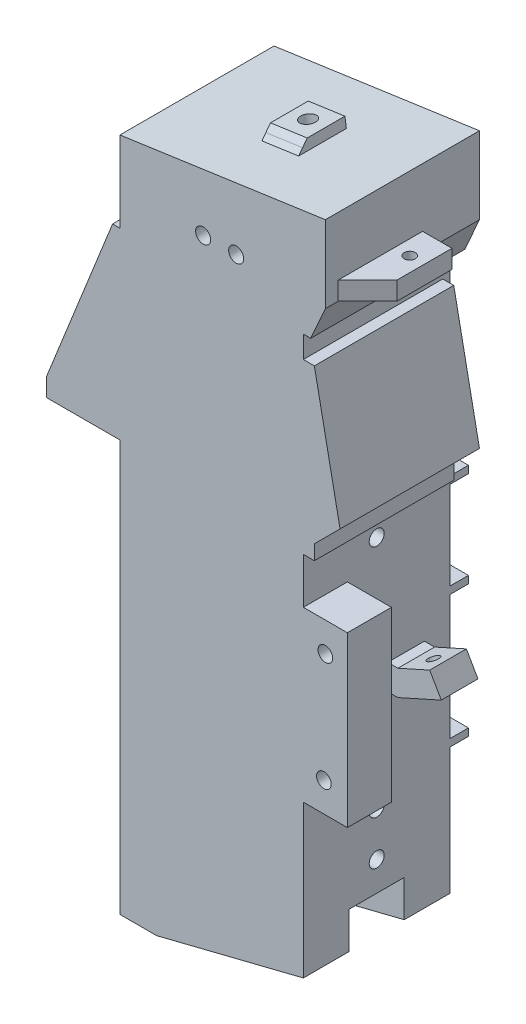
from build123d import *

# Parameters (mm, degrees)
CROQUIS1_W                  = 50
CROQUIS1_H                  = 184
SALIENTE_EXTRUIR1_DEPTH     = 40
CORTAR_EXTRUIR1_DEPTH       = 40
CROQUIS3_R                  = 2
SALIENTE_EXTRUIR2_DEPTH     = 40
SALIENTE_EXTRUIR3_DEPTH     = 38
SALIENTE_EXTRUIR4_DEPTH     = 40
CROQUIS9_W                  = 28
CROQUIS9_H                  = 46
CORTAR_EXTRUIR6_DEPTH       = 12
CORTAR_EXTRUIR8_DEPTH       = 12
CROQUIS13_W                 = 3.499793878
CROQUIS13_H                 = 12
SALIENTE_EXTRUIR5_DEPTH     = 12
CROQUIS14_R                 = 1.5
CORTAR_EXTRUIR9_DEPTH       = 12
CROQUIS16_W                 = 10
CROQUIS16_H                 = 6.928
SALIENTE_EXTRUIR6_DEPTH     = 2.773
SALIENTE_EXTRUIR7_DEPTH     = 5
CROQUIS19_R                 = 1.5
CORTAR_EXTRUIR10_DEPTH      = 10
CROQUIS20_W                 = 40
CROQUIS20_H                 = 15
CORTAR_EXTRUIR11_DEPTH      = 20
SALIENTE_EXTRUIR8_DEPTH     = 40
SALIENTE_EXTRUIR9_DEPTH     = 40
SALIENTE_EXTRUIR10_DEPTH    = 2
CROQUIS25_W                 = 18
CROQUIS25_H                 = 15
CORTAR_EXTRUIR12_DEPTH      = 45
CROQUIS26_R                 = 1.6
CORTAR_EXTRUIR13_DEPTH      = 45
SALIENTE_EXTRUIR11_DEPTH    = 1
CROQUIS29_W                 = 48.431
CROQUIS29_H                 = 1.5
CROQUIS29_W_2               = 1.5
CROQUIS29_H_2               = 41.5
SALIENTE_EXTRUIR12_DEPTH    = 1
CROQUIS30_W                 = 50
CROQUIS30_H                 = 2
SALIENTE_EXTRUIR13_DEPTH    = 5
SALIENTE_EXTRUIR14_DEPTH    = 24
CORTAR_EXTRUIR14_DEPTH      = 5
CROQUIS33_W                 = 50
CROQUIS33_H                 = 5
SALIENTE_EXTRUIR15_DEPTH    = 2
SALIENTE_EXTRUIR16_DEPTH    = 34
CROQUIS35_W                 = 50
CROQUIS35_H                 = 5
SALIENTE_EXTRUIR17_DEPTH    = 2
CROQUIS36_R                 = 1.6
CORTAR_EXTRUIR15_DEPTH      = 123.497795141
CROQUIS37_R                 = 2.05
CORTAR_EXTRUIR16_DEPTH      = 6
CROQUIS38_R                 = 2.05
CORTAR_EXTRUIR17_DEPTH      = 6
CROQUIS39_W                 = 10.109
CROQUIS39_H                 = 13
SALIENTE_EXTRUIR18_DEPTH    = 2.741
CORTAR_EXTRUIR18_DEPTH      = 123.414338069
CROQUIS42_R                 = 2.05
CORTAR_EXTRUIR19_DEPTH      = 6
CORTAR_EXTRUIR20_DEPTH      = 134.419994789
CORTAR_EXTRUIR20_DEPTH_BACK = 134.419994789
CROQUIS44_W                 = 64.640952058
CROQUIS44_H                 = 86.005379165
CORTAR_EXTRUIR21_DEPTH      = 134.419994789


with BuildPart() as part:
    # Croquis1 → Saliente-Extruir1 (new body)
    with BuildSketch(Plane.XY):
        Rectangle(CROQUIS1_W, CROQUIS1_H)
    saliente_extruir1 = extrude(amount=SALIENTE_EXTRUIR1_DEPTH)

    # Croquis2 → Cortar-Extruir1 (cut)
    with BuildSketch(Plane.XY.offset(40)):
        Polygon((-15, -92), (25, -82.000231953), (25, -92), align=None)
    cortar_extruir1 = extrude(amount=-CORTAR_EXTRUIR1_DEPTH, mode=Mode.SUBTRACT)

    # Croquis3 → Saliente-Extruir2 (add, through all)
    with BuildSketch(Plane.XY.offset(40)):
        Polygon((25, -40.500231953), (17.257871302, -40.500231953), (17.257871302, 5.499768047), (23, 5.499768047), (37, 5.499768047), (37, -40.500231953), align=None)
        with Locations((30.600037882, -32.500231953)):
            Circle(CROQUIS3_R, mode=Mode.SUBTRACT)
        with Locations((31, -2.500231953)):
            Circle(CROQUIS3_R, mode=Mode.SUBTRACT)
    saliente_extruir2 = extrude(amount=-SALIENTE_EXTRUIR2_DEPTH)

    # Croquis7 → Saliente-Extruir3 (add)
    with BuildSketch(Plane(origin=(0, 0, 0), x_dir=(-1, 0, 0), z_dir=(0, 0, -1))):
        Polygon((-25, 17.999768047), (-28, 17.999768047), (-28, 21.999768047), (-34.999650027, 28.999418074), (-27.999635566, 63.999275882), (-25, 63.999275882), align=None)
    saliente_extruir3 = extrude(amount=-SALIENTE_EXTRUIR3_DEPTH)

    # Croquis8 → Saliente-Extruir4 (add, through all)
    with BuildSketch(Plane(origin=(0, 0, 0), x_dir=(-1, 0, 0), z_dir=(0, 0, -1))):
        Polygon((-25, 69.999275882), (-27, 69.999275882), (-31.000138025, 78.999370147), (-42.314138025, 78.999370147), (-42.314138025, 83.999370147), (-31.000138025, 83.999370147), (-31.000138025, 92), (-25, 92), align=None)
    saliente_extruir4 = extrude(amount=-SALIENTE_EXTRUIR4_DEPTH)

    # Croquis9 → Cortar-Extruir6 (cut)
    with BuildSketch(Plane(origin=(37, 0, 0), x_dir=(0, 0, -1), z_dir=(1, 0, 0))):
        with Locations((-26, -17.500231953)):
            Rectangle(CROQUIS9_W, CROQUIS9_H)
    cortar_extruir6 = extrude(amount=-CORTAR_EXTRUIR6_DEPTH, mode=Mode.SUBTRACT)

    # Croquis10 → Cortar-Extruir8 (cut)
    with BuildSketch(Plane.XZ.offset(-78.999370147)):
        Polygon((31.000138025, 40), (31.000138025, 26.5), (39.000138025, 26.5), (39.000138025, 11.5), (30.999931903, 3.499793878), (31.000138025, 0), (42.314138025, 0), (42.314138025, 40), align=None)
    cortar_extruir8 = extrude(amount=-CORTAR_EXTRUIR8_DEPTH, mode=Mode.SUBTRACT)

    # Croquis13 → Saliente-Extruir5 (add)
    with BuildSketch(Plane(origin=(31.000138025, 0, 0), x_dir=(0, 0, -1), z_dir=(1, 0, 0))):
        with Locations((-1.749896939, 84.999370147)):
            Rectangle(CROQUIS13_W, CROQUIS13_H)
    saliente_extruir5 = extrude(amount=-SALIENTE_EXTRUIR5_DEPTH)

    # Croquis14 → Cortar-Extruir9 (cut)
    with BuildSketch(Plane.XZ.offset(-78.999370147)):
        with Locations(Location((35.000138025, 19, 0), (0, 0, 270))):
            Circle(CROQUIS14_R)
    cortar_extruir9 = extrude(amount=-CORTAR_EXTRUIR9_DEPTH, mode=Mode.SUBTRACT)

    # Croquis16 → Saliente-Extruir6 (add)
    with BuildSketch(Plane(origin=(25, 0, 0), x_dir=(0, 0, -1), z_dir=(1, 0, 0))):
        with Locations((-28, -22.455231953)):
            Rectangle(CROQUIS16_W, CROQUIS16_H)
    saliente_extruir6 = extrude(amount=SALIENTE_EXTRUIR6_DEPTH)

    # Croquis3D1 → Saliente-Extruir7 (add, symmetric)
    with BuildSketch(Plane(origin=(27.773, -25.919231953, 28), x_dir=(0.6249550138681161, 0.7806607654039639, 0), z_dir=(0, 0, -1))):
        Polygon((0, 0), (11.53931357, 5.90842943), (13.864409677, 0), (5.408417783, -4.329688336), align=None)
    saliente_extruir7 = extrude(amount=SALIENTE_EXTRUIR7_DEPTH, both=True)

    # Croquis19 → Cortar-Extruir10 (cut)
    with BuildSketch(Plane(origin=(14.363025456, -31.948019069, 0), x_dir=(0.9120665622973847, 0.41004217580516156, 0), z_dir=(0.4100421758051615, -0.9120665622973846, 0))):
        with Locations((22.66684637, 28)):
            Circle(CROQUIS19_R)
    cortar_extruir10 = extrude(amount=-CORTAR_EXTRUIR10_DEPTH, mode=Mode.SUBTRACT)

    # Croquis20 → Cortar-Extruir11 (cut)
    with BuildSketch(Plane.XZ.offset(92)):
        with Locations((5, 20)):
            Rectangle(CROQUIS20_W, CROQUIS20_H)
    cortar_extruir11 = extrude(amount=-CORTAR_EXTRUIR11_DEPTH, mode=Mode.SUBTRACT)

    # Croquis21 → Saliente-Extruir8 (add)
    with BuildSketch(Plane(origin=(0, 0, 0), x_dir=(-1, 0, 0), z_dir=(0, 0, -1))):
        Polygon((25, 70), (27, 70), (45, 25), (45, 20), (25, 20), align=None)
    saliente_extruir8 = extrude(amount=-SALIENTE_EXTRUIR8_DEPTH)

    # Croquis22 → Saliente-Extruir9 (add)
    with BuildSketch(Plane.XY.offset(40)):
        Polygon((-25, 92), (31.000138025, 99.999370147), (31.000138025, 92), align=None)
    saliente_extruir9 = extrude(amount=-SALIENTE_EXTRUIR9_DEPTH)

    # Croquis23 → Saliente-Extruir10 (add)
    with BuildSketch(Plane.XY.offset(40)):
        Polygon((-25, 70), (25, 69.999275882), (27, 69.999275882), (31.000138025, 78.999370147), (31.000138025, 99.999370147), (-25, 92), align=None)
    saliente_extruir10 = extrude(amount=SALIENTE_EXTRUIR10_DEPTH)

    # Croquis25 → Cortar-Extruir12 (cut)
    with BuildSketch(Plane(origin=(0, 70, 0), x_dir=(1, 0, 0), z_dir=(0, 1, 0))):
        with Locations((-36, -20)):
            Rectangle(CROQUIS25_W, CROQUIS25_H)
    cortar_extruir12 = extrude(amount=-CORTAR_EXTRUIR12_DEPTH, mode=Mode.SUBTRACT)

    # Croquis26 → Cortar-Extruir13 (cut)
    with BuildSketch(Plane(origin=(0, 25, 0), x_dir=(1, 0, 0), z_dir=(0, 1, 0))):
        with Locations(Location((-36, -20, 0), (0, 0, 270))):
            Circle(CROQUIS26_R)
    cortar_extruir13 = extrude(amount=-CORTAR_EXTRUIR13_DEPTH, mode=Mode.SUBTRACT)

    # Croquis28 → Saliente-Extruir11 (add)
    with BuildSketch(Plane.XY.offset(40)):
        Polygon((-30.431, 20), (18, 20), (18, 63), (-18.529, 63), (-30.431, 43.969), align=None)
    saliente_extruir11 = extrude(amount=SALIENTE_EXTRUIR11_DEPTH)

    # Croquis29 → Saliente-Extruir12 (add)
    with BuildSketch(Plane.XY.offset(41)):
        with Locations((-6.2155, 20.75)):
            Rectangle(CROQUIS29_W, CROQUIS29_H)
        with Locations((-15.169, 42.25)):
            Rectangle(CROQUIS29_W_2, CROQUIS29_H_2)
        Polygon((-15.919, 47.99), (18, 47.99), (18, 46.49), (-28.854364931, 46.49), (-27.916263938, 47.99), align=None)
    saliente_extruir12 = extrude(amount=SALIENTE_EXTRUIR12_DEPTH)

    # Croquis30 → Saliente-Extruir13 (add)
    with BuildSketch(Plane.XY.offset(40)):
        with Locations((0, 15.538)):
            Rectangle(CROQUIS30_W, CROQUIS30_H)
    saliente_extruir13 = extrude(amount=SALIENTE_EXTRUIR13_DEPTH)

    # Croquis31 → Saliente-Extruir14 (add)
    with BuildSketch(Plane.XZ.offset(-14.538)):
        Polygon((-25, 40), (-20.000095901, 45), (8.461904099, 45), (25, 40), align=None)
    saliente_extruir14 = extrude(amount=SALIENTE_EXTRUIR14_DEPTH)

    # Croquis32 → Cortar-Extruir14 (cut)
    with BuildSketch(Plane.XY.offset(45)):
        Polygon((-20.000095901, 14.538), (-25, 7.467175508), (-25, 14.538), align=None)
    cortar_extruir14 = extrude(amount=-CORTAR_EXTRUIR14_DEPTH, mode=Mode.SUBTRACT)

    # Croquis33 → Saliente-Extruir15 (add)
    with BuildSketch(Plane.XZ.offset(9.462)):
        with Locations((0, 42.5)):
            Rectangle(CROQUIS33_W, CROQUIS33_H)
    saliente_extruir15 = extrude(amount=SALIENTE_EXTRUIR15_DEPTH)

    # Croquis34 → Saliente-Extruir16 (add)
    with BuildSketch(Plane.XZ.offset(11.462)):
        Polygon((-25, 40), (-9.51943722, 45), (19.99956278, 45), (25, 40), align=None)
    saliente_extruir16 = extrude(amount=SALIENTE_EXTRUIR16_DEPTH)

    # Croquis35 → Saliente-Extruir17 (add)
    with BuildSketch(Plane.XZ.offset(45.462)):
        with Locations((0, 42.5)):
            Rectangle(CROQUIS35_W, CROQUIS35_H)
    saliente_extruir17 = extrude(amount=SALIENTE_EXTRUIR17_DEPTH)

    # Croquis36 → Cortar-Extruir15 (cut, through all)
    with BuildSketch(Plane(origin=(-15, 0, 0), x_dir=(0, 0, -1), z_dir=(1, 0, 0))):
        with Locations((-20, -82)):
            Circle(CROQUIS36_R)
    cortar_extruir15 = extrude(amount=-CORTAR_EXTRUIR15_DEPTH, mode=Mode.SUBTRACT)

    # Croquis37 → Cortar-Extruir16 (cut)
    with BuildSketch(Plane(origin=(25, 0, 0), x_dir=(0, 0, -1), z_dir=(1, 0, 0))):
        with Locations((-20, -64)):
            Circle(CROQUIS37_R)
        with Locations((-20, -52)):
            Circle(CROQUIS37_R)
        with Locations((-20, 12)):
            Circle(CROQUIS37_R)
    cortar_extruir16 = extrude(amount=-CORTAR_EXTRUIR16_DEPTH, mode=Mode.SUBTRACT)

    # Croquis38 → Cortar-Extruir17 (cut)
    with BuildSketch(Plane(origin=(0, 0, 0), x_dir=(-1, 0, 0), z_dir=(0, 0, -1))):
        with Locations((-6.684, 79.619334724)):
            Circle(CROQUIS38_R)
        with Locations((2.316, 79.619334724)):
            Circle(CROQUIS38_R)
    cortar_extruir17 = extrude(amount=-CORTAR_EXTRUIR17_DEPTH, mode=Mode.SUBTRACT)

    # Croquis39 → Saliente-Extruir18 (add)
    with BuildSketch(Plane(origin=(-13.378916452, 93.660019994, 0), x_dir=(0.9899511012015357, 0.14141010299786488, 0), z_dir=(-0.14141010299786488, 0.9899511012015357, 0))):
        with Locations((17.775042007, -21)):
            Rectangle(CROQUIS39_W, CROQUIS39_H)
    saliente_extruir18 = extrude(amount=SALIENTE_EXTRUIR18_DEPTH)

    # Croquis40 → Cortar-Extruir18 (cut, through all)
    with BuildSketch(Plane(origin=(12.592714568, 1.798813155, 0), x_dir=(0, 0, 1), z_dir=(-0.9899511012015357, -0.14141010299786488, 0))):
        Polygon((14.5, 94.610753885), (15.746, 95.869753885), (17.211, 97.351753885), (14.5, 97.351753885), align=None)
    cortar_extruir18 = extrude(amount=-CORTAR_EXTRUIR18_DEPTH, mode=Mode.SUBTRACT)

    # Croquis42 → Cortar-Extruir19 (cut)
    with BuildSketch(Plane(origin=(-13.766521544, 96.373475963, 0), x_dir=(0.9899511012015357, 0.14141010299786486, 0), z_dir=(-0.14141010299786486, 0.9899511012015357, 0))):
        with Locations(Location((17.720542007, -22.5, 0), (0, 0, 180))):
            Circle(CROQUIS42_R)
    cortar_extruir19 = extrude(amount=-CORTAR_EXTRUIR19_DEPTH, mode=Mode.SUBTRACT)

    # Simetría1: Saliente-Extruir1, Cortar-Extruir1, Saliente-Extruir2, Saliente-Extruir3, Saliente-Extruir4, Cortar-Extruir6, Cortar-Extruir8, Saliente-Extruir5, Cortar-Extruir9, Saliente-Extruir6, Saliente-Extruir7, Cortar-Extruir10, Cortar-Extruir11, Saliente-Extruir8, Saliente-Extruir9, Saliente-Extruir10, Cortar-Extruir12, Cortar-Extruir13, Saliente-Extruir11, Saliente-Extruir12, Saliente-Extruir13, Saliente-Extruir14, Cortar-Extruir14, Saliente-Extruir15, Saliente-Extruir16, Saliente-Extruir17, Cortar-Extruir15, Cortar-Extruir16, Cortar-Extruir17, Saliente-Extruir18, Cortar-Extruir18, Cortar-Extruir19 across plane
    add(saliente_extruir1.mirror(Plane(origin=(0, 0, 0), x_dir=(1, 0, 0), z_dir=(0, 0, -1))))
    add(cortar_extruir1.mirror(Plane(origin=(0, 0, 0), x_dir=(1, 0, 0), z_dir=(0, 0, -1))), mode=Mode.SUBTRACT)
    add(saliente_extruir2.mirror(Plane(origin=(0, 0, 0), x_dir=(1, 0, 0), z_dir=(0, 0, -1))))
    add(saliente_extruir3.mirror(Plane(origin=(0, 0, 0), x_dir=(1, 0, 0), z_dir=(0, 0, -1))))
    add(saliente_extruir4.mirror(Plane(origin=(0, 0, 0), x_dir=(1, 0, 0), z_dir=(0, 0, -1))))
    add(cortar_extruir6.mirror(Plane(origin=(0, 0, 0), x_dir=(1, 0, 0), z_dir=(0, 0, -1))), mode=Mode.SUBTRACT)
    add(cortar_extruir8.mirror(Plane(origin=(0, 0, 0), x_dir=(1, 0, 0), z_dir=(0, 0, -1))), mode=Mode.SUBTRACT)
    add(saliente_extruir5.mirror(Plane(origin=(0, 0, 0), x_dir=(1, 0, 0), z_dir=(0, 0, -1))))
    add(cortar_extruir9.mirror(Plane(origin=(0, 0, 0), x_dir=(1, 0, 0), z_dir=(0, 0, -1))), mode=Mode.SUBTRACT)
    add(saliente_extruir6.mirror(Plane(origin=(0, 0, 0), x_dir=(1, 0, 0), z_dir=(0, 0, -1))))
    add(saliente_extruir7.mirror(Plane(origin=(0, 0, 0), x_dir=(1, 0, 0), z_dir=(0, 0, -1))))
    add(cortar_extruir10.mirror(Plane(origin=(0, 0, 0), x_dir=(1, 0, 0), z_dir=(0, 0, -1))), mode=Mode.SUBTRACT)
    add(cortar_extruir11.mirror(Plane(origin=(0, 0, 0), x_dir=(1, 0, 0), z_dir=(0, 0, -1))), mode=Mode.SUBTRACT)
    add(saliente_extruir8.mirror(Plane(origin=(0, 0, 0), x_dir=(1, 0, 0), z_dir=(0, 0, -1))))
    add(saliente_extruir9.mirror(Plane(origin=(0, 0, 0), x_dir=(1, 0, 0), z_dir=(0, 0, -1))))
    add(saliente_extruir10.mirror(Plane(origin=(0, 0, 0), x_dir=(1, 0, 0), z_dir=(0, 0, -1))))
    add(cortar_extruir12.mirror(Plane(origin=(0, 0, 0), x_dir=(1, 0, 0), z_dir=(0, 0, -1))), mode=Mode.SUBTRACT)
    add(cortar_extruir13.mirror(Plane(origin=(0, 0, 0), x_dir=(1, 0, 0), z_dir=(0, 0, -1))), mode=Mode.SUBTRACT)
    add(saliente_extruir11.mirror(Plane(origin=(0, 0, 0), x_dir=(1, 0, 0), z_dir=(0, 0, -1))))
    add(saliente_extruir12.mirror(Plane(origin=(0, 0, 0), x_dir=(1, 0, 0), z_dir=(0, 0, -1))))
    add(saliente_extruir13.mirror(Plane(origin=(0, 0, 0), x_dir=(1, 0, 0), z_dir=(0, 0, -1))))
    add(saliente_extruir14.mirror(Plane(origin=(0, 0, 0), x_dir=(1, 0, 0), z_dir=(0, 0, -1))))
    add(cortar_extruir14.mirror(Plane(origin=(0, 0, 0), x_dir=(1, 0, 0), z_dir=(0, 0, -1))), mode=Mode.SUBTRACT)
    add(saliente_extruir15.mirror(Plane(origin=(0, 0, 0), x_dir=(1, 0, 0), z_dir=(0, 0, -1))))
    add(saliente_extruir16.mirror(Plane(origin=(0, 0, 0), x_dir=(1, 0, 0), z_dir=(0, 0, -1))))
    add(saliente_extruir17.mirror(Plane(origin=(0, 0, 0), x_dir=(1, 0, 0), z_dir=(0, 0, -1))))
    add(cortar_extruir15.mirror(Plane(origin=(0, 0, 0), x_dir=(1, 0, 0), z_dir=(0, 0, -1))), mode=Mode.SUBTRACT)
    add(cortar_extruir16.mirror(Plane(origin=(0, 0, 0), x_dir=(1, 0, 0), z_dir=(0, 0, -1))), mode=Mode.SUBTRACT)
    add(cortar_extruir17.mirror(Plane(origin=(0, 0, 0), x_dir=(1, 0, 0), z_dir=(0, 0, -1))), mode=Mode.SUBTRACT)
    add(saliente_extruir18.mirror(Plane(origin=(0, 0, 0), x_dir=(1, 0, 0), z_dir=(0, 0, -1))))
    add(cortar_extruir18.mirror(Plane(origin=(0, 0, 0), x_dir=(1, 0, 0), z_dir=(0, 0, -1))), mode=Mode.SUBTRACT)
    add(cortar_extruir19.mirror(Plane(origin=(0, 0, 0), x_dir=(1, 0, 0), z_dir=(0, 0, -1))), mode=Mode.SUBTRACT)

    # Croquis43 → Cortar-Extruir20 (cut, two sides: drawn at the far end of the back side and taken through both)
    with BuildSketch(Plane(origin=(31.000138025, 0, 0), x_dir=(0, 0, -1), z_dir=(1, 0, 0)).offset(-CORTAR_EXTRUIR20_DEPTH_BACK)):
        Polygon((0, -92), (0, 78.999370147), (-3.499793878, 78.999370147), (-3.499793878, 90.999370147), (-3.5, 90.999370147), (-3.5, 83.999370147), (-26.5, 83.999370147), (-26.5, 78.999370147), (-42, 78.999370147), (-42, 99.999370147), (-89.715915191, 99.999370147), (-89.715915191, -92), align=None)
    extrude(amount=CORTAR_EXTRUIR20_DEPTH + CORTAR_EXTRUIR20_DEPTH_BACK, mode=Mode.SUBTRACT)

    # Croquis44 → Cortar-Extruir21 (cut, through all)
    with BuildSketch(Plane(origin=(31.000138025, 0, 0), x_dir=(0, 0, -1), z_dir=(1, 0, 0))):
        with Locations((-32.320476029, 95.928740373)):
            Rectangle(CROQUIS44_W, CROQUIS44_H)
    extrude(amount=-CORTAR_EXTRUIR21_DEPTH, mode=Mode.SUBTRACT)


solid = part.part
